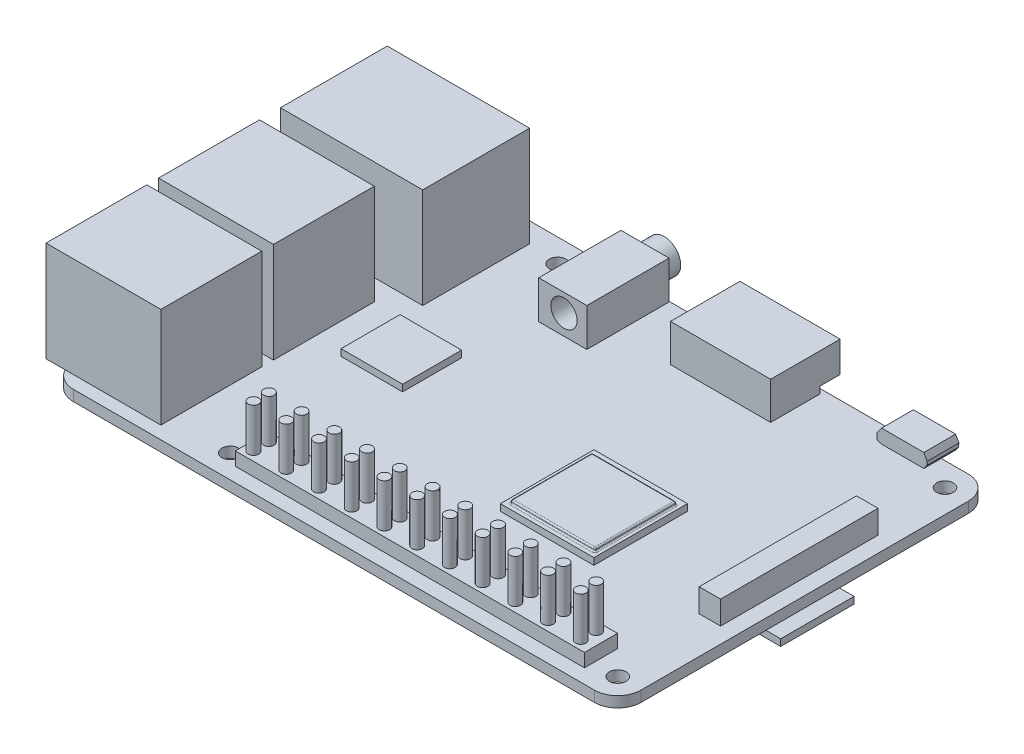
from build123d import *

# Parameters (mm, degrees)
SKETCH1_W            = 85
SKETCH1_H            = 56
BOSS_EXTRUDE1_DEPTH  = 1.6
FILLET1_R            = 3.5
SKETCH2_W            = 21.3
SKETCH2_H            = 16
SKETCH2_W_2          = 17.2
SKETCH2_H_2          = 15.1
BOSS_EXTRUDE2_DEPTH  = 15
CUT_EXTRUDE1_DEPTH   = 12
SKETCH4_W            = 11.328789485
SKETCH4_H            = 4.176822404
SKETCH4_W_2          = 11.217902348
SKETCH4_H_2          = 4.510412328
SKETCH4_W_3          = 10.917217982
SKETCH4_W_4          = 10.654367841
CUT_EXTRUDE2_DEPTH   = 12
SKETCH5_W            = 9.215132462
SKETCH5_H            = 8.834185872
BOSS_EXTRUDE3_DEPTH  = 1
SKETCH6_W            = 15
SKETCH6_H            = 10.4
BOSS_EXTRUDE4_DEPTH  = 5.6
SKETCH8_W            = 14
SKETCH8_H            = 14
BOSS_EXTRUDE5_DEPTH  = 1
CUT_EXTRUDE5_DEPTH   = 3
CUT_EXTRUDE6_DEPTH   = 8
SKETCH11_W           = 12.427225968
SKETCH11_H           = 1.17514326
BOSS_EXTRUDE6_DEPTH  = 8
SKETCH12_W           = 12.613180269
SKETCH12_H           = 12.185850886
BOSS_EXTRUDE7_DEPTH  = 0.5
FILLET3_R            = 0.2
SKETCH13_W           = 7.8
SKETCH13_H           = 4.758054275
BOSS_EXTRUDE8_DEPTH  = 2.5
CUT_EXTRUDE7_REACH   = 106.233
SKETCH14_W           = 7.8
SKETCH14_H           = 2.5
SKETCH15_W           = 5.737959944
SKETCH15_H           = 0.901908774
CUT_EXTRUDE8_DEPTH   = 2.5
SKETCH16_W           = 8.858375881
SKETCH16_H           = 11
BOSS_EXTRUDE9_DEPTH  = 1
SKETCH17_W           = 7.2
SKETCH17_H           = 15
BOSS_EXTRUDE10_DEPTH = 5.7
SKETCH18_W           = 7.2
SKETCH18_H           = 5.7
SKETCH18_R           = 2.483687513
CUT_EXTRUDE9_DEPTH   = 2.7
SKETCH19_R           = 1.971700338
CUT_EXTRUDE10_DEPTH  = 15
SKETCH20_W           = 3.216274487
SKETCH20_H           = 23.561651756
BOSS_EXTRUDE11_DEPTH = 3.5
SKETCH21_W           = 52.265092814
SKETCH21_H           = 4.95298862
BOSS_EXTRUDE12_DEPTH = 2
SKETCH26_R           = 0.785406627
BOSS_EXTRUDE14_DEPTH = 6.5
SKETCH27_R           = 1.25
CUT_EXTRUDE11_DEPTH  = 3


with BuildPart() as part:
    # Sketch1 → Boss-Extrude1 (new body)
    with BuildSketch(Plane(origin=(0, 0, 0), x_dir=(1, 0, 0), z_dir=(0, 1, 0))):
        with Locations((42.5, 28)):
            Rectangle(SKETCH1_W, SKETCH1_H)
    extrude(amount=BOSS_EXTRUDE1_DEPTH)

    # Fillet1
    fillet1_edges = [part.edges().sort_by_distance(p)[0] for p in [
        (0, 0.8, -56),
        (85, 0.8, -56),
        (85, 0.8, 0),
        (0, 0.8, 0),
    ]]
    fillet(fillet1_edges, radius=FILLET1_R)

    # Sketch2 → Boss-Extrude2 (add)
    with BuildSketch(Plane(origin=(0, 1.6, 0), x_dir=(1, 0, 0), z_dir=(0, 1, 0))):
        with Locations((8.15, 45.006339437)):
            Rectangle(SKETCH2_W, SKETCH2_H)
        with Locations((6.1, 26.316339437)):
            Rectangle(SKETCH2_W_2, SKETCH2_H_2)
        with Locations((6.1, 9.462585291)):
            Rectangle(SKETCH2_W_2, SKETCH2_H_2)
    extrude(amount=BOSS_EXTRUDE2_DEPTH)

    # Sketch3 → Cut-Extrude1 (cut)
    with BuildSketch(Plane.ZY.offset(2.5)):
        Polygon((-45.866668429, 4.338404817), (-51.151626976, 4.338404817), (-51.151626976, 14.796056273), (-38.50023729, 14.796056273), (-38.50023729, 4.338404817), (-43.056945622, 4.338404817), (-43.056945622, 3.50556074), (-45.866668429, 3.50556074), align=None)
    extrude(amount=-CUT_EXTRUDE1_DEPTH, mode=Mode.SUBTRACT)

    # Sketch4 → Cut-Extrude2 (cut)
    with BuildSketch(Plane.ZY.offset(2.5)):
        with Locations((-26.461798859, 5.231351606)):
            Rectangle(SKETCH4_W, SKETCH4_H)
        with Locations((-26.406355291, 12.463864305)):
            Rectangle(SKETCH4_W_2, SKETCH4_H_2)
        with Locations((-9.380681386, 12.463864305)):
            Rectangle(SKETCH4_W_3, SKETCH4_H_2)
        with Locations((-9.249256316, 5.231351606)):
            Rectangle(SKETCH4_W_4, SKETCH4_H)
    extrude(amount=-CUT_EXTRUDE2_DEPTH, mode=Mode.SUBTRACT)

    # Sketch5 → Boss-Extrude3 (add)
    with BuildSketch(Plane(origin=(0, 1.6, 0), x_dir=(1, 0, 0), z_dir=(0, 1, 0))):
        with Locations((23.881530139, 28.725879739)):
            Rectangle(SKETCH5_W, SKETCH5_H)
    extrude(amount=BOSS_EXTRUDE3_DEPTH)

    # Sketch6 → Boss-Extrude4 (add)
    with BuildSketch(Plane(origin=(0, 1.6, 0), x_dir=(1, 0, 0), z_dir=(0, 1, 0))):
        with Locations((52.5, 53.1)):
            Rectangle(SKETCH6_W, SKETCH6_H)
    extrude(amount=BOSS_EXTRUDE4_DEPTH)

    # Sketch8 → Boss-Extrude5 (add)
    with BuildSketch(Plane(origin=(0, 1.6, 0), x_dir=(1, 0, 0), z_dir=(0, 1, 0))):
        with Locations((58.300756438, 23.141467805)):
            Rectangle(SKETCH8_W, SKETCH8_H)
    extrude(amount=BOSS_EXTRUDE5_DEPTH)

    # Sketch9 → Cut-Extrude5 (cut)
    with BuildSketch(Plane(origin=(0, 0, -58.3), x_dir=(-1, 0, 0), z_dir=(0, 0, -1))):
        Polygon((-60, 1.6), (-45, 1.6), (-45, 2.662665486), (-45.531332743, 2.131332743), (-59.516352361, 2.131332743), (-60, 2.614980382), align=None)
    extrude(amount=-CUT_EXTRUDE5_DEPTH, mode=Mode.SUBTRACT)

    # Sketch10 → Cut-Extrude6 (cut)
    with BuildSketch(Plane(origin=(0, 0, -58.3), x_dir=(-1, 0, 0), z_dir=(0, 0, -1))):
        Polygon((-59.600066368, 6.695032251), (-45.394068764, 6.695032251), (-45.394068764, 2.907308434), (-45.871426816, 2.429950382), (-59.122708316, 2.429950382), (-59.600066368, 2.907308434), align=None)
    extrude(amount=-CUT_EXTRUDE6_DEPTH, mode=Mode.SUBTRACT)

    # Sketch11 → Boss-Extrude6 (add)
    with BuildSketch(Plane(origin=(0, 0, -50.3), x_dir=(-1, 0, 0), z_dir=(0, 0, -1))):
        with Locations((-52.462367448, 4.773466718)):
            Rectangle(SKETCH11_W, SKETCH11_H)
    extrude(amount=BOSS_EXTRUDE6_DEPTH)

    # Sketch12 → Boss-Extrude7 (add)
    with BuildSketch(Plane(origin=(0, 2.6, 0), x_dir=(1, 0, 0), z_dir=(0, 1, 0))):
        with Locations((58.346877097, 23.017031035)):
            Rectangle(SKETCH12_W, SKETCH12_H)
    extrude(amount=BOSS_EXTRUDE7_DEPTH)

    # Fillet3
    fillet3_edges = [part.edges().sort_by_distance(p)[0] for p in [
        (64.653467232, 2.6, -23.017031035),
        (64.653467232, 2.85, -16.924105592),
        (58.346877097, 2.6, -29.109956478),
        (64.653467232, 2.85, -29.109956478),
        (52.040286963, 2.6, -23.017031035),
        (52.040286963, 2.85, -29.109956478),
        (58.346877097, 2.6, -16.924105592),
        (52.040286963, 2.85, -16.924105592),
        (64.653467232, 3.1, -23.017031035),
        (58.346877097, 3.1, -29.109956478),
        (52.040286963, 3.1, -23.017031035),
        (58.346877097, 3.1, -16.924105592),
    ]]
    fillet(fillet3_edges, radius=FILLET3_R)

    # Sketch13 → Boss-Extrude8 (add)
    with BuildSketch(Plane(origin=(0, 1.6, 0), x_dir=(1, 0, 0), z_dir=(0, 1, 0))):
        with Locations((74.4, 55.620972863)):
            Rectangle(SKETCH13_W, SKETCH13_H)
    extrude(amount=BOSS_EXTRUDE8_DEPTH)

    # Sketch14 → Cut-Extrude7 (cut, up to next)
    with BuildSketch(Plane(origin=(0, 0, -58), x_dir=(-1, 0, 0), z_dir=(0, 0, -1)), mode=Mode.PRIVATE) as cut_extrude7_sk1:
        with Locations((-74.4, 2.85)):
            Rectangle(SKETCH14_W, SKETCH14_H)
        Polygon((-78.082838188, 2.931276393), (-77.588308668, 3.832882532), (-71.270821509, 3.832882532), (-70.614287246, 2.931276393), (-70.614287246, 1.985137808), (-71.270821509, 1.750697876), (-77.588308668, 1.750697876), (-78.017105162, 2.339556026), align=None, mode=Mode.SUBTRACT)
    cut_extrude7_tool1 = extrude(cut_extrude7_sk1.sketch, amount=-CUT_EXTRUDE7_REACH, mode=Mode.PRIVATE) & part.part
    add(cut_extrude7_tool1.solids().sort_by_distance((74.4, 4.018092, -58))[0], mode=Mode.SUBTRACT)


with BuildPart() as cut_extrude7_piece_1:
    # of the separate pieces the step leaves, piece 1, a body of its own (cut_extrude7_pieces)
    add(part.part.solids().sort_by_distance((64.853467232, 2.6, -28.909956478))[0])

    # Sketch16 → Boss-Extrude9 (add)
    with BuildSketch(Plane.XZ):
        with Locations((82.77081206, -27.7)):
            Rectangle(SKETCH16_W, SKETCH16_H)
    extrude(amount=BOSS_EXTRUDE9_DEPTH)

    # Sketch17 → Boss-Extrude10 (add)
    with BuildSketch(Plane(origin=(0, 1.6, 0), x_dir=(1, 0, 0), z_dir=(0, 1, 0))):
        with Locations((33.180940633, 51.1)):
            Rectangle(SKETCH17_W, SKETCH17_H)
    extrude(amount=BOSS_EXTRUDE10_DEPTH)

    # Sketch18 → Cut-Extrude9 (cut)
    with BuildSketch(Plane(origin=(0, 0, -58.6), x_dir=(-1, 0, 0), z_dir=(0, 0, -1))):
        with Locations((-33.180940633, 4.45)):
            Rectangle(SKETCH18_W, SKETCH18_H)
        with Locations((-33.351775405, 4.551644337)):
            Circle(SKETCH18_R, mode=Mode.SUBTRACT)
    extrude(amount=-CUT_EXTRUDE9_DEPTH, mode=Mode.SUBTRACT)

    # Sketch19 → Cut-Extrude10 (cut)
    with BuildSketch(Plane(origin=(0, 0, -58.6), x_dir=(-1, 0, 0), z_dir=(0, 0, -1))):
        with Locations((-33.353921247, 4.61075129)):
            Circle(SKETCH19_R)
    extrude(amount=-CUT_EXTRUDE10_DEPTH, mode=Mode.SUBTRACT)

    # Sketch20 → Boss-Extrude11 (add)
    with BuildSketch(Plane(origin=(0, 1.6, 0), x_dir=(1, 0, 0), z_dir=(0, 1, 0))):
        with Locations((81.049905205, 29.529238465)):
            Rectangle(SKETCH20_W, SKETCH20_H)
    extrude(amount=BOSS_EXTRUDE11_DEPTH)

    # Sketch21 → Boss-Extrude12 (add)
    with BuildSketch(Plane(origin=(0, 1.6, 0), x_dir=(1, 0, 0), z_dir=(0, 1, 0))):
        with Locations((51.744420854, 4.618280945)):
            Rectangle(SKETCH21_W, SKETCH21_H)
    extrude(amount=BOSS_EXTRUDE12_DEPTH)

    # Sketch26 → Boss-Extrude14 (add)
    with BuildSketch(Plane(origin=(0, 3.6, 0), x_dir=(1, 0, 0), z_dir=(0, 1, 0))):
        with Locations(Location((27.007482061, 5.771861959, 0), (0, 0, 90))):
            Circle(SKETCH26_R)
        with Locations(Location((31.907482061, 5.771861959, 0), (0, 0, 90))):
            Circle(SKETCH26_R)
        with Locations(Location((36.807482061, 5.771861959, 0), (0, 0, 90))):
            Circle(SKETCH26_R)
        with Locations(Location((41.707482061, 5.771861959, 0), (0, 0, 90))):
            Circle(SKETCH26_R)
        with Locations(Location((46.607482061, 5.771861959, 0), (0, 0, 90))):
            Circle(SKETCH26_R)
        with Locations(Location((51.507482061, 5.771861959, 0), (0, 0, 90))):
            Circle(SKETCH26_R)
        with Locations(Location((56.407482061, 5.771861959, 0), (0, 0, 90))):
            Circle(SKETCH26_R)
        with Locations(Location((61.307482061, 5.771861959, 0), (0, 0, 90))):
            Circle(SKETCH26_R)
        with Locations(Location((66.207482061, 5.771861959, 0), (0, 0, 90))):
            Circle(SKETCH26_R)
        with Locations(Location((71.107482061, 5.771861959, 0), (0, 0, 90))):
            Circle(SKETCH26_R)
        with Locations(Location((76.007482061, 5.771861959, 0), (0, 0, 90))):
            Circle(SKETCH26_R)
        with Locations(Location((31.907482061, 3.471861959, 0), (0, 0, 90))):
            Circle(SKETCH26_R)
        with Locations(Location((36.807482061, 3.471861959, 0), (0, 0, 90))):
            Circle(SKETCH26_R)
        with Locations(Location((41.707482061, 3.471861959, 0), (0, 0, 90))):
            Circle(SKETCH26_R)
        with Locations(Location((46.607482061, 3.471861959, 0), (0, 0, 90))):
            Circle(SKETCH26_R)
        with Locations(Location((51.507482061, 3.471861959, 0), (0, 0, 90))):
            Circle(SKETCH26_R)
        with Locations(Location((56.407482061, 3.471861959, 0), (0, 0, 90))):
            Circle(SKETCH26_R)
        with Locations(Location((61.307482061, 3.471861959, 0), (0, 0, 90))):
            Circle(SKETCH26_R)
        with Locations(Location((66.207482061, 3.471861959, 0), (0, 0, 90))):
            Circle(SKETCH26_R)
        with Locations(Location((71.107482061, 3.471861959, 0), (0, 0, 90))):
            Circle(SKETCH26_R)
        with Locations(Location((76.007482061, 3.471861959, 0), (0, 0, 90))):
            Circle(SKETCH26_R)
        with Locations(Location((27.007482061, 3.471861959, 0), (0, 0, 90))):
            Circle(SKETCH26_R)
    extrude(amount=BOSS_EXTRUDE14_DEPTH)

    # Sketch27 → Cut-Extrude11 (cut)
    with BuildSketch(Plane(origin=(0, 1.6, 0), x_dir=(1, 0, 0), z_dir=(0, 1, 0))):
        with Locations(Location((81.5, 3.5, 0), (0, 0, 270))):
            Circle(SKETCH27_R)
        with Locations(Location((81.5, 52.5, 0), (0, 0, 270))):
            Circle(SKETCH27_R)
        with Locations(Location((23.5, 52.5, 0), (0, 0, 270))):
            Circle(SKETCH27_R)
        with Locations(Location((23.5, 3.5, 0), (0, 0, 270))):
            Circle(SKETCH27_R)
    extrude(amount=-CUT_EXTRUDE11_DEPTH, mode=Mode.SUBTRACT)


with BuildPart() as cut_extrude7_piece_2:
    # of the separate pieces the step leaves, piece 2, a body of its own (cut_extrude7_pieces)
    add(part.part.solids().sort_by_distance((77.588308668, 1.750697876, -53.241945725))[0])

    # Sketch15 → Cut-Extrude8 (cut)
    with BuildSketch(Plane(origin=(0, 0, -58), x_dir=(-1, 0, 0), z_dir=(0, 0, -1))):
        with Locations((-74.345138822, 2.661468634)):
            Rectangle(SKETCH15_W, SKETCH15_H)
    extrude(amount=-CUT_EXTRUDE8_DEPTH, mode=Mode.SUBTRACT)


solid = Compound([cut_extrude7_piece_1.part, cut_extrude7_piece_2.part])
